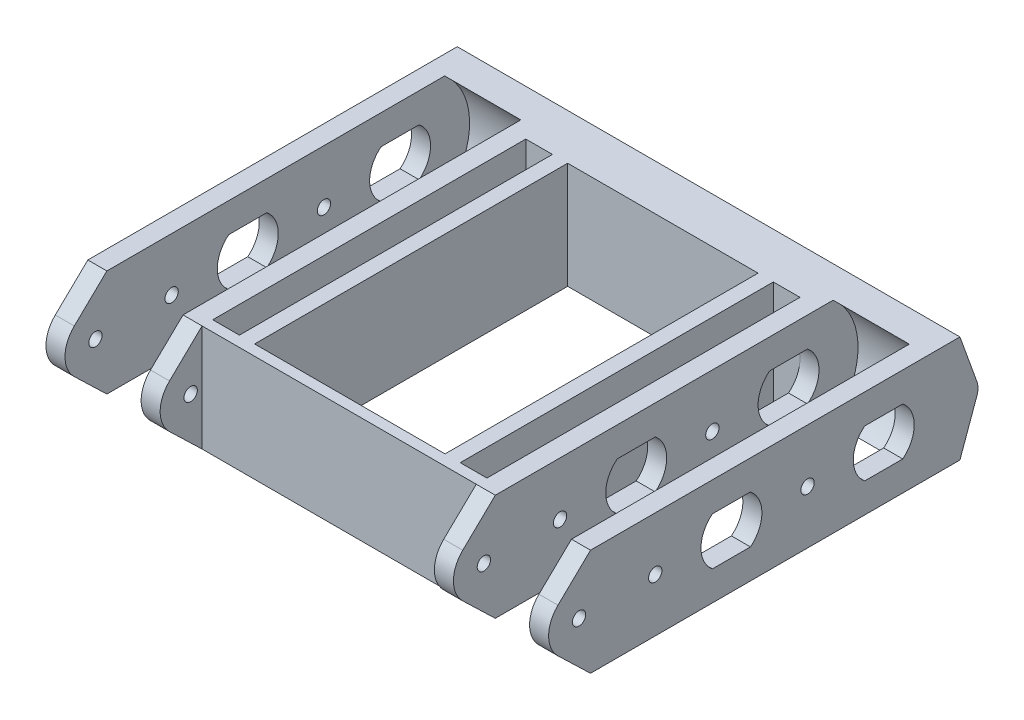
from build123d import *

# Parameters (mm, degrees)
BOSS_EXTRUDE1_DEPTH = 66
CUT_EXTRUDE3_START  = -5
CUT_EXTRUDE3_DEPTH  = 20
CUT_EXTRUDE4_START  = -5
SKETCH5_W           = 82.2
SKETCH5_H           = 28
CUT_EXTRUDE4_DEPTH  = 7
CUT_EXTRUDE5_START  = 29
SKETCH1_13_R        = 1.75
CUT_EXTRUDE5_DEPTH  = 37
SKETCH7_W           = 72
SKETCH7_H           = 11
CUT_EXTRUDE7_DEPTH  = 97.605188784
SKETCH8_W           = 50
SKETCH8_H           = 82.2
CUT_EXTRUDE8_DEPTH  = 97.605188784


with BuildPart() as part:
    # Sketch1 → Boss-Extrude1 (new, symmetric)
    with BuildSketch(Plane(origin=(0, 0, 0), x_dir=(0, 0, -1), z_dir=(1, 0, 0))):
        with BuildLine():
            Line((60, 14), (64.468246011, 1.611607143))
            ThreePointArc((64.468246011, 1.611607143), (64.75, 0), (64.468246011, -1.611607143))
            Line((64.468246011, -1.611607143), (60, -14))
            Line((60, -14), (-37, -14))
            Line((-37, -14), (-45.550860067, -5.760898586))
            ThreePointArc((-45.550860067, -5.760898586), (-48, 0), (-45.550860067, 5.760898586))
            Line((-45.550860067, 5.760898586), (-37, 14))
            Line((-37, 14), (60, 14))
        make_face()
    extrude(amount=BOSS_EXTRUDE1_DEPTH, both=True)

    # Sketch4 → Cut-Extrude3 (cut)
    with BuildSketch(Plane(origin=(66, 0, 0), x_dir=(0, 0, -1), z_dir=(1, 0, 0)).offset(CUT_EXTRUDE3_START)):
        with BuildLine():
            ThreePointArc((51.707369474, -14), (58.25, 0), (51.707369474, 14))
            Line((51.707369474, 14), (-37, 14))
            Line((-37, 14), (-45.550860067, 5.760898586))
            ThreePointArc((-45.550860067, 5.760898586), (-48, 0), (-45.550860067, -5.760898586))
            Line((-45.550860067, -5.760898586), (-37, -14))
            Line((-37, -14), (51.707369474, -14))
        make_face()
    cut_extrude3 = extrude(amount=-CUT_EXTRUDE3_DEPTH, mode=Mode.SUBTRACT)

    # Sketch5 → Cut-Extrude4 (cut)
    with BuildSketch(Plane(origin=(41, 0, 0), x_dir=(0, 0, -1), z_dir=(1, 0, 0)).offset(CUT_EXTRUDE4_START)):
        with Locations((6.9, 0)):
            Rectangle(SKETCH5_W, SKETCH5_H)
    cut_extrude4 = extrude(amount=-CUT_EXTRUDE4_DEPTH, mode=Mode.SUBTRACT)

    # Sketch1<13> → Cut-Extrude5 (cut)
    with BuildSketch(Plane(origin=(0, 0, 0), x_dir=(0, 0, -1), z_dir=(1, 0, 0)).offset(CUT_EXTRUDE5_START)):
        with BuildLine():
            Line((4.993746089, -6.25), (-4.993746089, -6.25))
            ThreePointArc((-4.993746089, -6.25), (-8, 0), (-4.993746089, 6.25))
            Line((-4.993746089, 6.25), (4.993746089, 6.25))
            ThreePointArc((4.993746089, 6.25), (8, 0), (4.993746089, -6.25))
        make_face()
        with BuildLine():
            Line((44.993746089, -6.25), (35.006253911, -6.25))
            ThreePointArc((35.006253911, -6.25), (32, 0), (35.006253911, 6.25))
            Line((35.006253911, 6.25), (44.993746089, 6.25))
            ThreePointArc((44.993746089, 6.25), (48, 0), (44.993746089, -6.25))
        make_face()
        with Locations((-20, 0)):
            Circle(SKETCH1_13_R)
        with Locations((20, 0)):
            Circle(SKETCH1_13_R)
        with Locations((-40, 0)):
            Circle(SKETCH1_13_R)
    cut_extrude5 = extrude(amount=CUT_EXTRUDE5_DEPTH, mode=Mode.SUBTRACT)

    # Mirror2: Cut-Extrude3, Cut-Extrude4, Cut-Extrude5 across plane
    add(cut_extrude3.mirror(Plane(origin=(0, 0, 0), x_dir=(0, 0, 1), z_dir=(1, 0, 0))), mode=Mode.SUBTRACT)
    add(cut_extrude4.mirror(Plane(origin=(0, 0, 0), x_dir=(0, 0, 1), z_dir=(1, 0, 0))), mode=Mode.SUBTRACT)
    add(cut_extrude5.mirror(Plane(origin=(0, 0, 0), x_dir=(0, 0, 1), z_dir=(1, 0, 0))), mode=Mode.SUBTRACT)

    # Sketch7 → Cut-Extrude7 (cut, through all)
    with BuildSketch(Plane(origin=(0, 14, 0), x_dir=(1, 0, 0), z_dir=(0, 1, 0))):
        with Locations((0, -42.5)):
            Rectangle(SKETCH7_W, SKETCH7_H)
    extrude(amount=-CUT_EXTRUDE7_DEPTH, mode=Mode.SUBTRACT)

    # Sketch8 → Cut-Extrude8 (cut, through all)
    with BuildSketch(Plane(origin=(0, 14, 0), x_dir=(1, 0, 0), z_dir=(0, 1, 0))):
        with Locations((0, 6.9)):
            Rectangle(SKETCH8_W, SKETCH8_H)
    extrude(amount=-CUT_EXTRUDE8_DEPTH, mode=Mode.SUBTRACT)


solid = part.part
